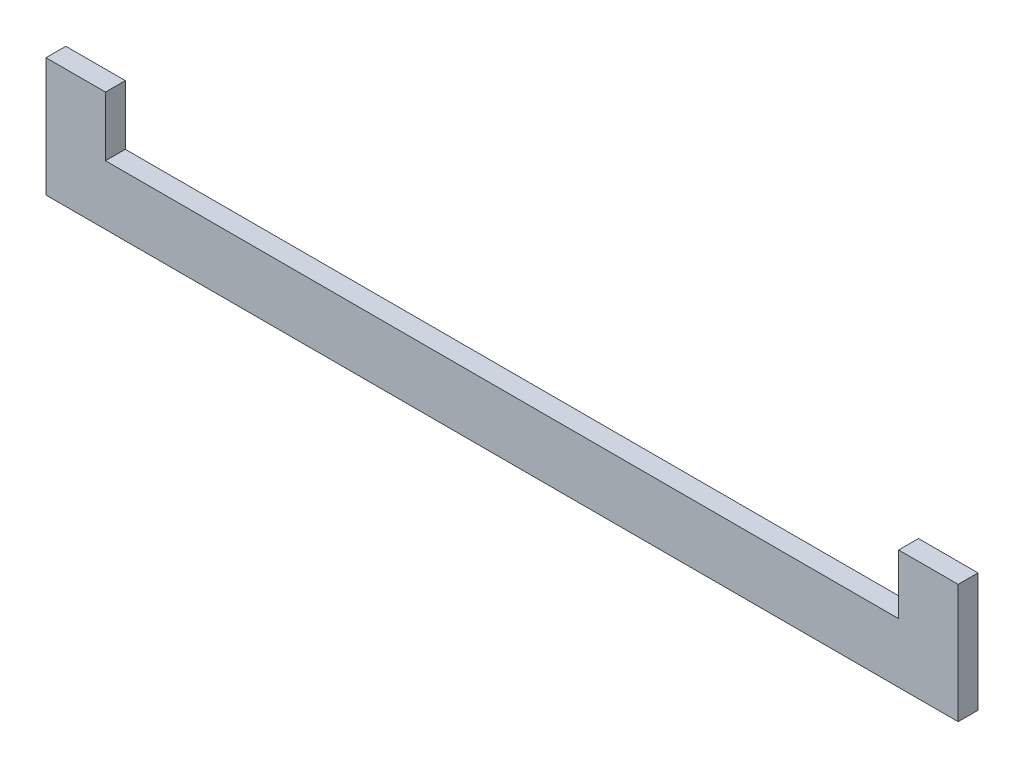
from build123d import *

# Parameters (mm, degrees)
SALIENTE_EXTRUIR1_DEPTH = 5


with BuildPart() as part:
    # Croquis1 → Saliente-Extruir1 (new body)
    with BuildSketch(Plane.XY):
        Polygon((-84.875213559, 50), (115.124786441, 50), (115.124786441, 65), (130.124786441, 65), (130.124786441, 35), (115.124786441, 35), (-84.875213559, 35), (-99.875213559, 35), (-99.875213559, 65), (-84.875213559, 65), align=None)
    extrude(amount=SALIENTE_EXTRUIR1_DEPTH)


solid = part.part
